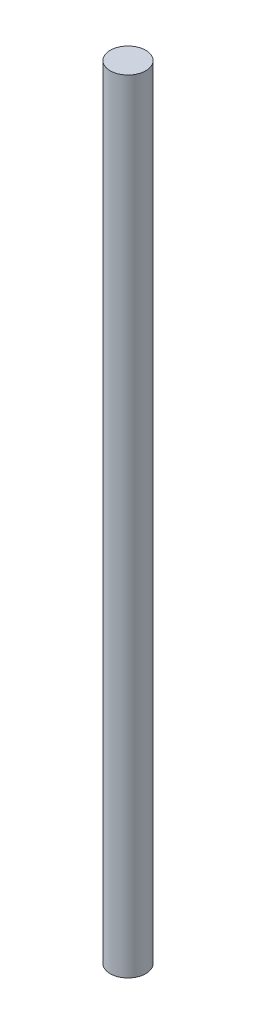
from build123d import *

# Parameters (mm, degrees)
SKETCH1_R           = 2.5
BOSS_EXTRUDE1_DEPTH = 55


with BuildPart() as part:
    # Sketch1 → Boss-Extrude1 (new, symmetric)
    with BuildSketch(Plane(origin=(0, 0, 0), x_dir=(1, 0, 0), z_dir=(0, 1, 0))):
        with Locations(Location((0, 0, 0), (0, 0, 270))):
            Circle(SKETCH1_R)
    extrude(amount=BOSS_EXTRUDE1_DEPTH, both=True)


solid = part.part
